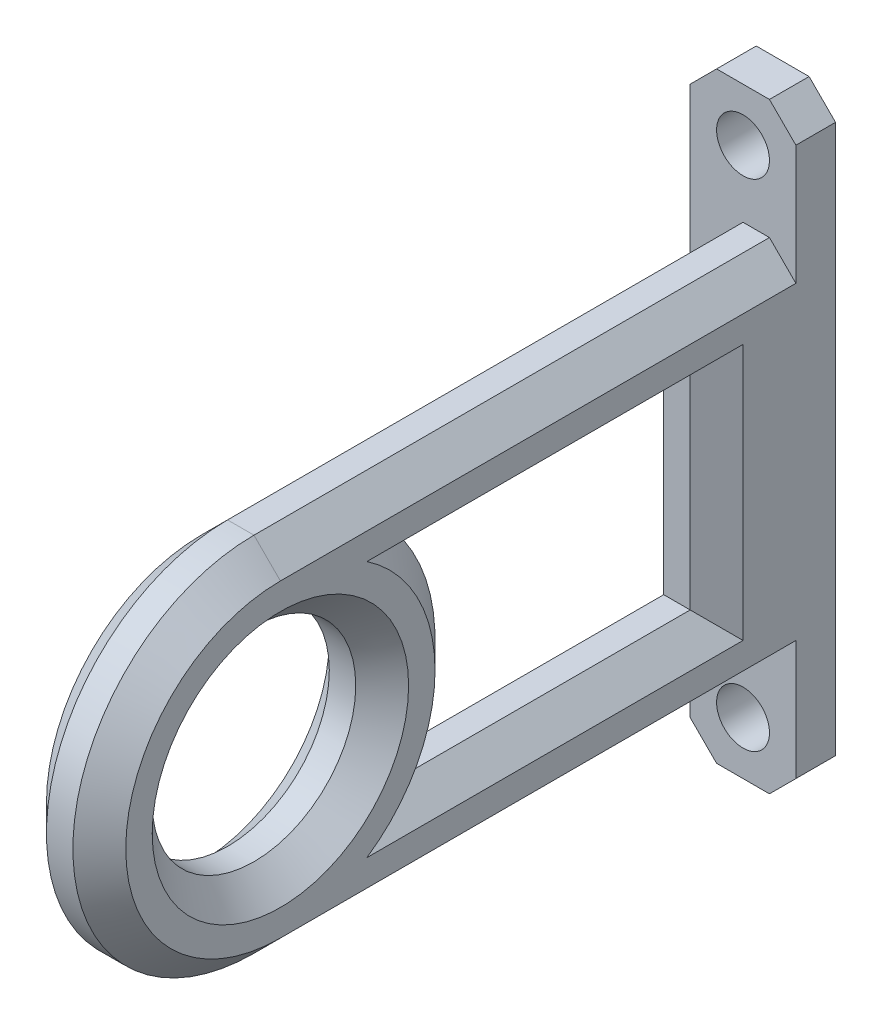
from build123d import *

# Parameters (mm, degrees)
SKETCH1_R           = 7.7
BOSS_EXTRUDE1_DEPTH = 6
CHAMFER1_SIZE       = 2
SKETCH4_W           = 8
SKETCH4_H           = 45.5
SKETCH4_R           = 2
BOSS_EXTRUDE2_DEPTH = 3
CHAMFER2_SIZE       = 2


with BuildPart() as part:
    # Sketch1 → Boss-Extrude1 (new body)
    with BuildSketch(Plane(origin=(0, 0, 0), x_dir=(0, 0, -1), z_dir=(1, 0, 0))):
        with BuildLine():
            Line((0, 13.7), (39, 13.7))
            Line((39, 13.7), (39, -13.7))
            Line((39, -13.7), (0, -13.7))
            ThreePointArc((0, -13.7), (-13.7, 0), (0, 13.7))
        make_face()
        Circle(SKETCH1_R, mode=Mode.SUBTRACT)
        with BuildLine():
            Line((11.331372379, 7.7), (33, 7.7))
            Line((33, 7.7), (33, -7.7))
            Line((33, -7.7), (11.331372379, -7.7))
            ThreePointArc((11.331372379, -7.7), (13.7, 0), (11.331372379, 7.7))
        make_face(mode=Mode.SUBTRACT)
    extrude(amount=BOSS_EXTRUDE1_DEPTH)

    # Chamfer1
    chamfer1_edges = [part.edges().sort_by_distance(p)[0] for p in [
        (6, 13.7, -19.5),
        (0, 0, -33),
        (0, 7.7, -22.16568619),
        (0, 0, -13.7),
        (0, -7.7, -22.16568619),
        (6, 0, -33),
        (6, 7.7, -22.16568619),
        (6, 0, -13.7),
        (6, -7.7, -22.16568619),
        (0, 0, 7.7),
        (6, 0, 7.7),
        (6, 0, 13.7),
        (0, 13.7, -19.5),
        (0, -13.7, -19.5),
        (0, 0, 13.7),
        (6, -13.7, -19.5),
    ]]
    chamfer(chamfer1_edges, length=CHAMFER1_SIZE)

    # Sketch4 → Boss-Extrude2 (add)
    with BuildSketch(Plane(origin=(0, 0, -39), x_dir=(-1, 0, 0), z_dir=(0, 0, -1))):
        with Locations((-2, 0)):
            Rectangle(SKETCH4_W, SKETCH4_H)
        with Locations((-2, 18.75)):
            Circle(SKETCH4_R, mode=Mode.SUBTRACT)
        with Locations(Location((-2, -18.75, 0), (0, 0, 180))):
            Circle(SKETCH4_R, mode=Mode.SUBTRACT)
    extrude(amount=BOSS_EXTRUDE2_DEPTH)

    # Chamfer2
    chamfer2_edges = [part.edges().sort_by_distance(p)[0] for p in [
        (6, -22.75, -40.5),
        (-2, -22.75, -40.5),
        (6, 22.75, -40.5),
        (-2, 22.75, -40.5),
    ]]
    chamfer(chamfer2_edges, length=CHAMFER2_SIZE)


solid = part.part
